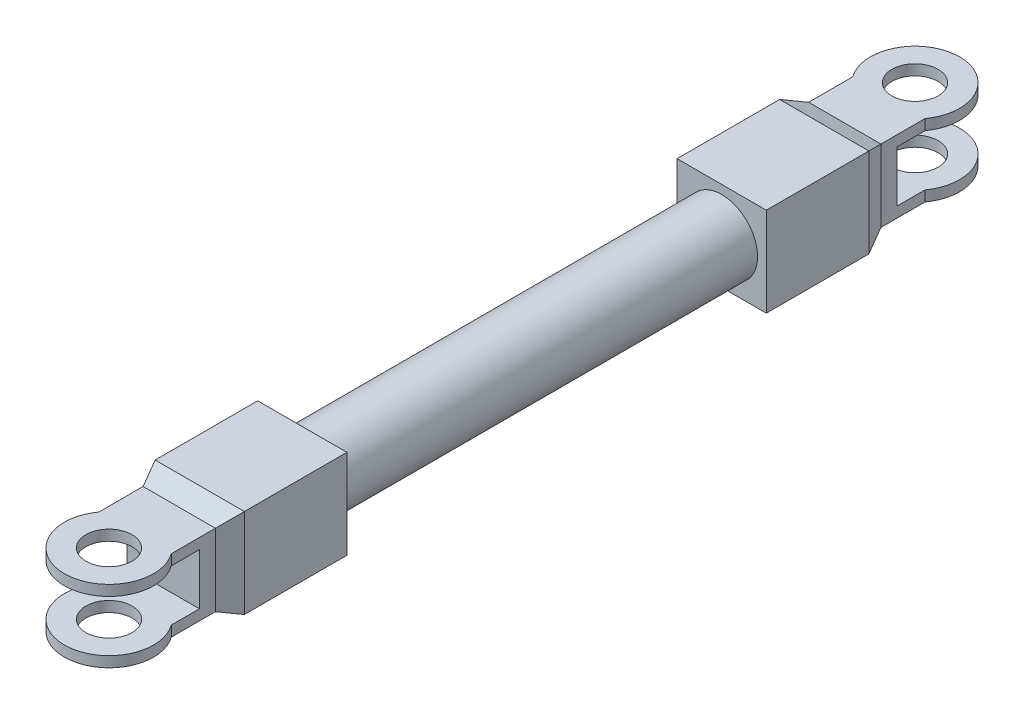
from build123d import *

# Parameters (mm, degrees)
SKETCH2_R                = 70
BOSS_EXTRUDE2_DEPTH      = 1018
SKETCH4_W                = 174
SKETCH4_H                = 174
BOSS_EXTRUDE3_DEPTH      = 100
SKETCH7_W                = 174
SKETCH7_H                = 174
BOSS_EXTRUDE4_DEPTH      = 100
SKETCH14_R               = 87
BOSS_EXTRUDE5_DEPTH      = 141
SKETCH16_R               = 45
CUT_EXTRUDE1_DEPTH       = 141
BOSS_EXTRUDE6_REACH      = 1305.818
BOSS_EXTRUDE6_END_RADIUS = 87
SKETCH17_W               = 141
SKETCH17_H               = 141
SKETCH23_W               = 196.221845396
SKETCH23_H               = 100
CUT_EXTRUDE2_DEPTH       = 201
BOSS_EXTRUDE7_DEPTH      = 70.5
SKETCH26_R               = 45
CUT_EXTRUDE3_DEPTH       = 141
CUT_EXTRUDE4_START       = -187.5
SKETCH28_W               = 279.509799424
SKETCH28_H               = 100
CUT_EXTRUDE4_DEPTH       = 174


with BuildPart() as part:
    # Sketch2 → Boss-Extrude2 (new body)
    with BuildSketch(Plane.XY):
        Circle(SKETCH2_R)
    extrude(amount=-BOSS_EXTRUDE2_DEPTH)

    # Sketch4 → Boss-Extrude3 (add, symmetric)
    with BuildSketch(Plane.XY):
        Rectangle(SKETCH4_W, SKETCH4_H)
    extrude(amount=BOSS_EXTRUDE3_DEPTH, both=True)

    # Sketch7 → Boss-Extrude4 (add, symmetric)
    with BuildSketch(Plane(origin=(0, 0, -1018), x_dir=(-1, 0, 0), z_dir=(0, 0, -1))):
        Rectangle(SKETCH7_W, SKETCH7_H)
    extrude(amount=BOSS_EXTRUDE4_DEPTH, both=True)

    # Sketch8 → section 1 of loft1
    with BuildSketch(Plane.XY.offset(140), mode=Mode.PRIVATE) as loft1_s1:
        with BuildLine():
            Line((-70.5, 70.5), (70.5, 70.5))
            Line((70.5, 70.5), (70.5, -70.5))
            Line((70.5, -70.5), (-70.5, -70.5))
            Line((-70.5, -70.5), (-70.5, 70.5))
        make_face()
    # loft from a face of the part (loft1)
    loft([part.faces().sort_by_distance((0, 0, 100))[0], loft1_s1.sketch])

    # Sketch10 → section 1 of loft8
    with BuildSketch(Plane(origin=(0, 0, -1158), x_dir=(-1, 0, 0), z_dir=(0, 0, -1)), mode=Mode.PRIVATE) as loft8_s1:
        with BuildLine():
            Line((-70.5, 70.5), (70.5, 70.5))
            Line((70.5, 70.5), (70.5, -70.5))
            Line((70.5, -70.5), (-70.5, -70.5))
            Line((-70.5, -70.5), (-70.5, 70.5))
        make_face()
    # loft from a face of the part (loft8)
    loft([part.faces().sort_by_distance((0, 0, -1118))[0], loft8_s1.sketch])



with BuildPart() as body_2:
    # Sketch14 → Boss-Extrude5 (new body)
    with BuildSketch(Plane(origin=(0, 70.5, 0), x_dir=(-1, 0, 0), z_dir=(0, 1, 0))):
        with Locations(Location((0, 277, 0), (0, 0, 90))):
            Circle(SKETCH14_R)
    extrude(amount=-BOSS_EXTRUDE5_DEPTH)

    # Sketch16 → Cut-Extrude1 (cut)
    with BuildSketch(Plane(origin=(0, 70.5, 0), x_dir=(1, 0, 0), z_dir=(0, 1, 0))):
        with Locations(Location((0, -277, 0), (0, 0, 270))):
            Circle(SKETCH16_R)
    extrude(amount=-CUT_EXTRUDE1_DEPTH, mode=Mode.SUBTRACT)


with BuildPart() as part_1:
    add(part.part)

    add(body_2.part)  # Boss-Extrude6 merges body 2
    # Boss-Extrude6: up to this cylinder (the profile starts outside it)
    boss_extrude6_end = Plane(origin=(0, 0, 277), z_dir=(0, 1, 0)) * Cylinder(BOSS_EXTRUDE6_END_RADIUS, 2786.636, mode=Mode.PRIVATE)
    # Sketch17 → Boss-Extrude6 (add, up to the surface)
    with BuildSketch(Plane.XY.offset(140), mode=Mode.PRIVATE) as boss_extrude6_sk1:
        Rectangle(SKETCH17_W, SKETCH17_H)
    boss_extrude6_tool1 = extrude(boss_extrude6_sk1.sketch, amount=BOSS_EXTRUDE6_REACH, mode=Mode.PRIVATE) - boss_extrude6_end
    add(boss_extrude6_tool1.solids().sort_by_distance((0, 0, 140))[0])

    # Sketch23 → Cut-Extrude2 (cut)
    with BuildSketch(Plane.ZY.offset(94.5)):
        with Locations((269.287462291, 0)):
            Rectangle(SKETCH23_W, SKETCH23_H)
    extrude(amount=-CUT_EXTRUDE2_DEPTH, mode=Mode.SUBTRACT)


with BuildPart() as body_2_2:
    # Sketch24 → Boss-Extrude7 (new, symmetric)
    with BuildSketch(Plane(origin=(0, 0, 0), x_dir=(1, 0, 0), z_dir=(0, 1, 0))):
        with BuildLine():
            Line((-70.5, 1158), (70.5, 1158))
            Line((70.5, 1158), (70.5, 1244.022063596))
            ThreePointArc((70.5, 1244.022063596), (0, 1382), (-70.5, 1244.022063596))
            Line((-70.5, 1244.022063596), (-70.5, 1158))
        make_face()
    extrude(amount=BOSS_EXTRUDE7_DEPTH, both=True)

    # Sketch26 → Cut-Extrude3 (cut)
    with BuildSketch(Plane(origin=(0, 70.5, 0), x_dir=(1, 0, 0), z_dir=(0, 1, 0))):
        with Locations(Location((0, 1295, 0), (0, 0, 270))):
            Circle(SKETCH26_R)
    extrude(amount=-CUT_EXTRUDE3_DEPTH, mode=Mode.SUBTRACT)

    # Sketch28 → Cut-Extrude4 (cut)
    with BuildSketch(Plane.ZY.offset(100.5).offset(CUT_EXTRUDE4_START)):
        with Locations((-1328.934899712, 0)):
            Rectangle(SKETCH28_W, SKETCH28_H)
    extrude(amount=CUT_EXTRUDE4_DEPTH, mode=Mode.SUBTRACT)


solid = Compound([part_1.part, body_2_2.part])
